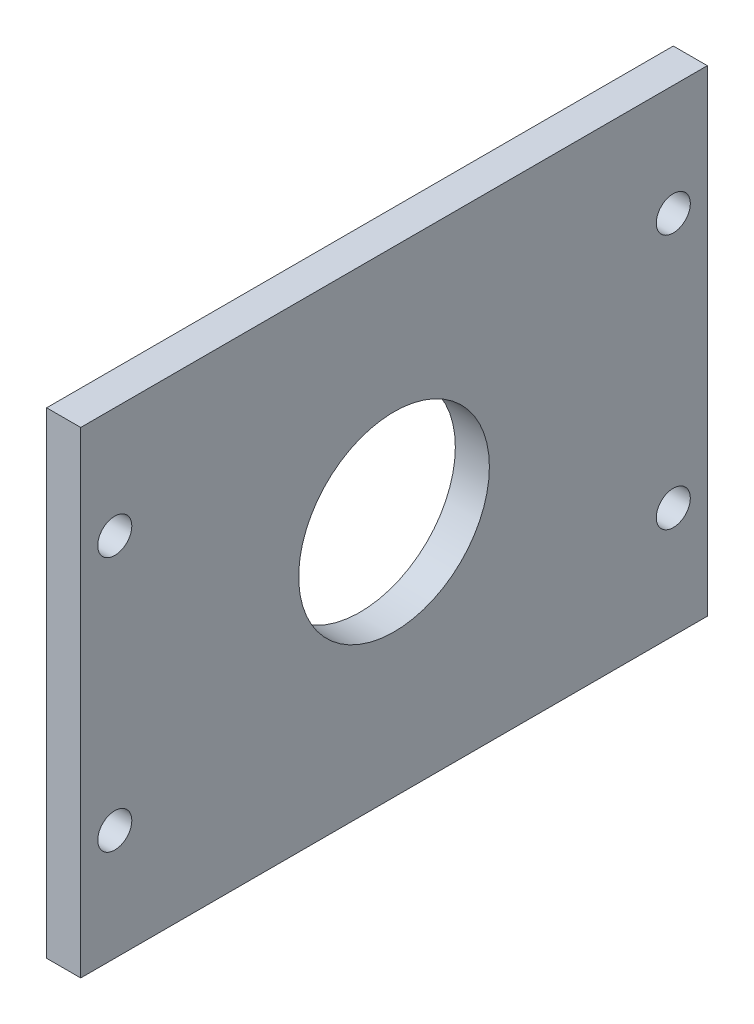
from build123d import *

# Parameters (mm, degrees)
SKETCH1_W               = 92
SKETCH1_H               = 70
SKETCH1_R               = 14
BOSS_EXTRUDE1_DEPTH     = 5
CUT_EXTRUDE1_DEPTH      = 116.71084651
CUT_EXTRUDE1_DEPTH_BACK = 116.71084651
SKETCH2_R               = 2.5


with BuildPart() as part:
    # Sketch1 → Boss-Extrude1 (new body)
    with BuildSketch(Plane(origin=(0, 0, 0), x_dir=(0, 0, -1), z_dir=(1, 0, 0))):
        with Locations((46, -35)):
            Rectangle(SKETCH1_W, SKETCH1_H)
        with Locations((46, -35)):
            Circle(SKETCH1_R, mode=Mode.SUBTRACT)
    extrude(amount=BOSS_EXTRUDE1_DEPTH)

    # Sketch2 → Cut-Extrude1 (cut, two sides: drawn at the far end of the back side and taken through both)
    with BuildSketch(Plane(origin=(5, 0, 0), x_dir=(0, 0, -1), z_dir=(1, 0, 0)).offset(-CUT_EXTRUDE1_DEPTH_BACK)):
        with Locations((5, -16.272445859)):
            Circle(SKETCH2_R)
        with Locations((5, -53.727554141)):
            Circle(SKETCH2_R)
        with Locations((87, -53.727554141)):
            Circle(SKETCH2_R)
        with Locations((87, -16.272445859)):
            Circle(SKETCH2_R)
    extrude(amount=CUT_EXTRUDE1_DEPTH + CUT_EXTRUDE1_DEPTH_BACK, mode=Mode.SUBTRACT)


solid = part.part
